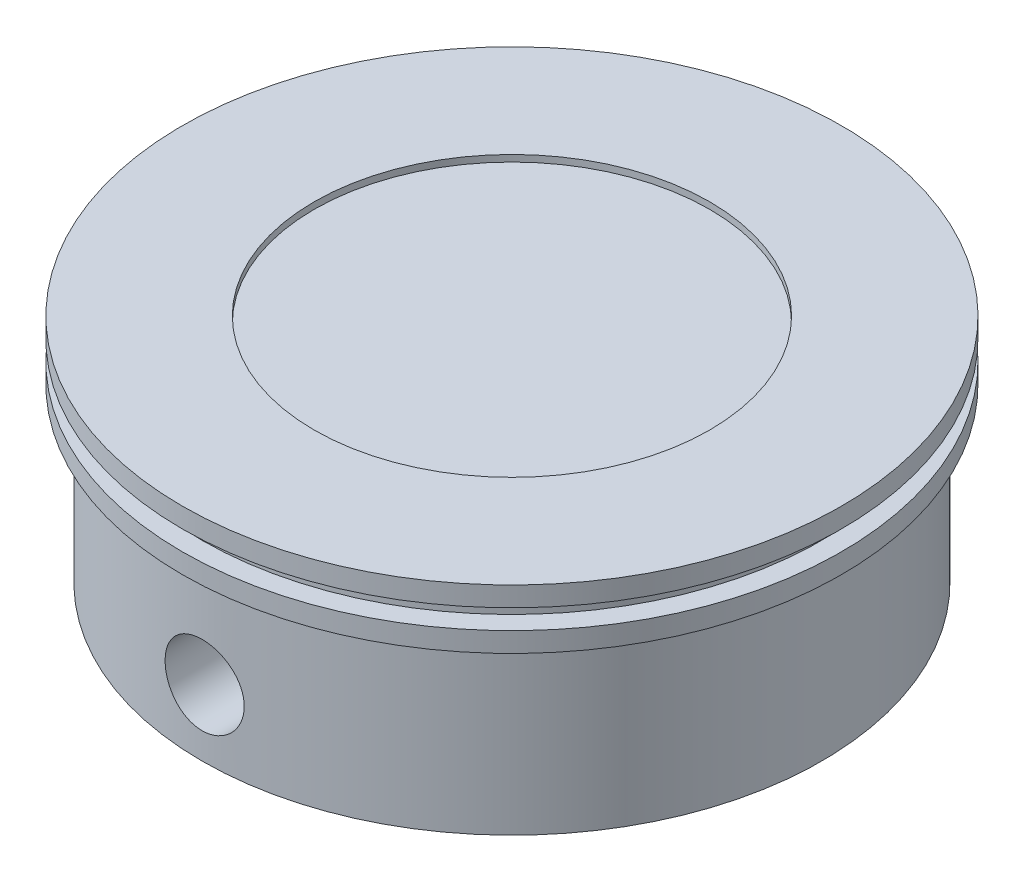
from build123d import *

# Parameters (mm, degrees)
SKETCH3_R          = 30
CUT_EXTRUDE1_DEPTH = 27
SKETCH4_R          = 6
CUT_EXTRUDE2_DEPTH = 112.118324226
CUT_EXTRUDE3_START = -1
SKETCH5_R          = 30
CUT_EXTRUDE3_DEPTH = 1


with BuildPart() as part:
    # Sketch2 → Revolve1 (revolve)
    with BuildSketch(Plane.XY, mode=Mode.PRIVATE) as revolve1_sk:
        Polygon((0, -14.064814815), (47, -14.064814815), (47, 11.935185185), (50, 11.935185185), (50, 14.935185185), (47, 14.935185185), (47, 17.935185185), (50, 17.935185185), (50, 20.935185185), (0, 20.935185185), align=None)
    revolve(revolve1_sk.sketch.rotate(Axis((0, 20.935185185, 0), (0, -1, 0)), 90), axis=Axis((0, 20.935185185, 0), (0, -1, 0)))

    # Sketch3 → Cut-Extrude1 (cut)
    with BuildSketch(Plane.XZ.offset(14.064814815)):
        with Locations(Location((0, 0, 0), (0, 0, 270))):
            Circle(SKETCH3_R)
    extrude(amount=-CUT_EXTRUDE1_DEPTH, mode=Mode.SUBTRACT)

    # Sketch4 → Cut-Extrude2 (cut, through all)
    with BuildSketch(Plane.XY.offset(47)):
        with Locations((0, -4.064814815)):
            Circle(SKETCH4_R)
    extrude(amount=-CUT_EXTRUDE2_DEPTH, mode=Mode.SUBTRACT)

    # Sketch5 → Cut-Extrude3 (cut)
    with BuildSketch(Plane(origin=(0, 20.935185185, 0), x_dir=(1, 0, 0), z_dir=(0, 1, 0)).offset(CUT_EXTRUDE3_START)):
        with Locations(Location((0, 0, 0), (0, 0, 90))):
            Circle(SKETCH5_R)
    extrude(amount=CUT_EXTRUDE3_DEPTH, mode=Mode.SUBTRACT)


solid = part.part
